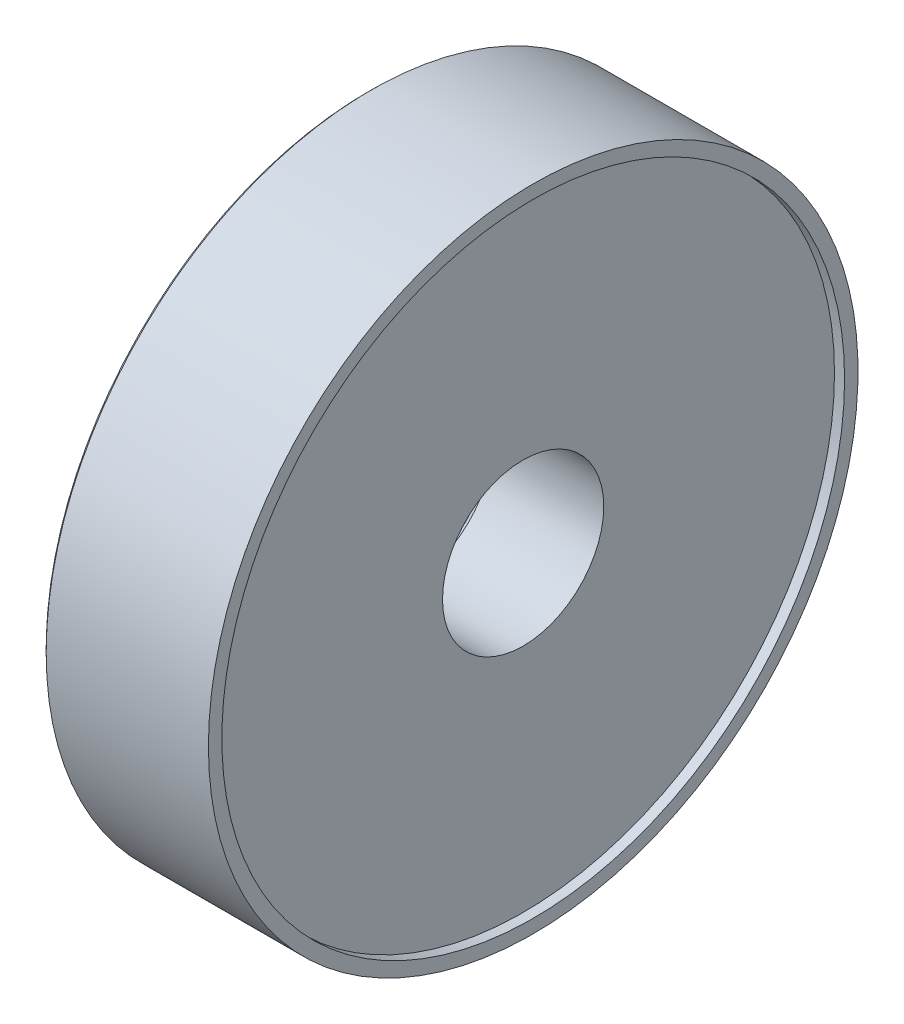
from build123d import *

# Parameters (mm, degrees)
SKETCH1_R                    = 48.35
BOSS_EXTRUDE1_DEPTH          = 12.575
SKETCH2_R                    = 1.25
CUT_EXTRUDE1_DEPTH           = 3
CHAMFER1_SIZE                = 0.5
CIRPATTERN1_COUNT            = 6
CHAMFER1_OF_CIRPATTERN1_SIZE = 0.5
SKETCH3_R                    = 12
CUT_EXTRUDE2_DEPTH           = 25.15
CHAMFER2_SIZE                = 1.25
CHAMFER3_SIZE                = 0.5
SKETCH4_R                    = 28.25
CUT_EXTRUDE3_DEPTH           = 5.35
SKETCH5_R                    = 3.5
BOSS_EXTRUDE2_DEPTH          = 3.85
SKETCH6_R                    = 1.25
CUT_EXTRUDE4_DEPTH           = 5.85
SKETCH7_R                    = 46.35
CUT_EXTRUDE5_DEPTH           = 2
SKETCH8_R                    = 48.35
SKETCH8_R_2                  = 46.35
CUT_EXTRUDE6_DEPTH           = 0.5
CHAMFER4_SIZE                = 1.25


with BuildPart() as part:
    # Sketch1 → Boss-Extrude1 (new, symmetric)
    with BuildSketch(Plane(origin=(0, 0, 0), x_dir=(0, 0, -1), z_dir=(1, 0, 0))):
        with Locations(Location((0, 0, 0), (0, 0, 180))):
            Circle(SKETCH1_R)
    extrude(amount=BOSS_EXTRUDE1_DEPTH, both=True)

    # Sketch2 → Cut-Extrude1 (cut)
    with BuildSketch(Plane.ZY.offset(12.575)):
        with Locations((0, 43.35)):
            Circle(SKETCH2_R)
    cut_extrude1 = extrude(amount=-CUT_EXTRUDE1_DEPTH, mode=Mode.SUBTRACT)

    # Chamfer1
    chamfer1_edges = [part.edges().sort_by_distance(p)[0] for p in [
        (-12.575, 43.35, -1.25),
    ]]
    chamfer(chamfer1_edges, length=CHAMFER1_SIZE)

    # CirPattern1: Cut-Extrude1 ×6 about axis
    cirpattern1_axis = Axis((0, 0, 0), (1, 0, 0))
    for i in range(1, CIRPATTERN1_COUNT):
        add(cut_extrude1.rotate(cirpattern1_axis, i * 360 / CIRPATTERN1_COUNT), mode=Mode.SUBTRACT)

    # Chamfer1 of CirPattern1
    chamfer1_of_cirpattern1_edges = [part.edges().sort_by_distance(p)[0] for p in [
        (-12.575, 22.757531755, 36.917201254),
        (-12.575, -20.592468245, 38.167201254),
        (-12.575, -43.35, 1.25),
        (-12.575, -22.757531755, -36.917201254),
        (-12.575, 20.592468245, -38.167201254),
    ]]
    chamfer(chamfer1_of_cirpattern1_edges, length=CHAMFER1_OF_CIRPATTERN1_SIZE)

    # Sketch3 → Cut-Extrude2 (cut)
    with BuildSketch(Plane.ZY.offset(12.575)):
        Circle(SKETCH3_R)
    extrude(amount=-CUT_EXTRUDE2_DEPTH, mode=Mode.SUBTRACT)

    # Chamfer2
    chamfer2_edges = [part.edges().sort_by_distance(p)[0] for p in [
        (-12.575, 0, -12),
    ]]
    chamfer(chamfer2_edges, length=CHAMFER2_SIZE)

    # Chamfer3
    chamfer3_edges = [part.edges().sort_by_distance(p)[0] for p in [
        (-12.575, 0, -48.35),
    ]]
    chamfer(chamfer3_edges, length=CHAMFER3_SIZE)

    # Sketch4 → Cut-Extrude3 (cut)
    with BuildSketch(Plane.ZY.offset(12.575)):
        Circle(SKETCH4_R)
    extrude(amount=-CUT_EXTRUDE3_DEPTH, mode=Mode.SUBTRACT)

    # Sketch5 → Boss-Extrude2 (add)
    with BuildSketch(Plane.ZY.offset(7.225)):
        with Locations(Location((-15.5, 15.5, 0), (0, 0, 180))):
            Circle(SKETCH5_R)
        with Locations(Location((15.5, 15.5, 0), (0, 0, 180))):
            Circle(SKETCH5_R)
        with Locations(Location((15.5, -15.5, 0), (0, 0, 180))):
            Circle(SKETCH5_R)
        with Locations(Location((-15.5, -15.5, 0), (0, 0, 180))):
            Circle(SKETCH5_R)
    extrude(amount=BOSS_EXTRUDE2_DEPTH)

    # Sketch6 → Cut-Extrude4 (cut)
    with BuildSketch(Plane.ZY.offset(11.075)):
        with Locations((-15.5, 15.5)):
            Circle(SKETCH6_R)
        with Locations((15.5, 15.5)):
            Circle(SKETCH6_R)
        with Locations((15.5, -15.5)):
            Circle(SKETCH6_R)
        with Locations((-15.5, -15.5)):
            Circle(SKETCH6_R)
    extrude(amount=-CUT_EXTRUDE4_DEPTH, mode=Mode.SUBTRACT)

    # Sketch7 → Cut-Extrude5 (cut)
    with BuildSketch(Plane(origin=(12.575, 0, 0), x_dir=(0, 0, -1), z_dir=(1, 0, 0))):
        Circle(SKETCH7_R)
    extrude(amount=-CUT_EXTRUDE5_DEPTH, mode=Mode.SUBTRACT)

    # Sketch8 → Cut-Extrude6 (cut)
    with BuildSketch(Plane(origin=(12.575, 0, 0), x_dir=(0, 0, -1), z_dir=(1, 0, 0))):
        with Locations(Location((0, 0, 0), (0, 0, 180))):
            Circle(SKETCH8_R)
        Circle(SKETCH8_R_2, mode=Mode.SUBTRACT)
    extrude(amount=-CUT_EXTRUDE6_DEPTH, mode=Mode.SUBTRACT)

    # Chamfer4
    chamfer4_edges = [part.edges().sort_by_distance(p)[0] for p in [
        (-7.225, 0, -12),
    ]]
    chamfer(chamfer4_edges, length=CHAMFER4_SIZE)


solid = part.part
